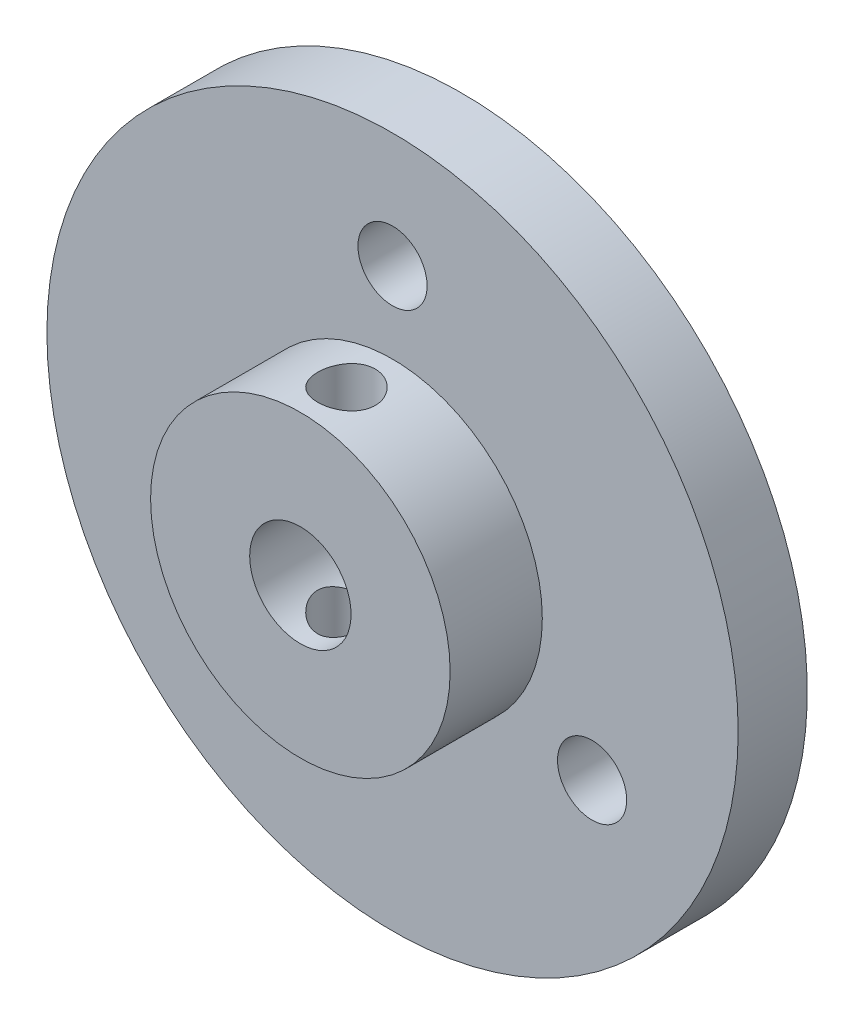
from build123d import *

# Parameters (mm, degrees)
SKETCH1_R               = 15
SKETCH1_R_2             = 2.2
SKETCH1_R_3             = 1.5
BOSS_EXTRUDE1_DEPTH     = 5
SKETCH2_R               = 6.5
SKETCH2_R_2             = 2.2
BOSS_EXTRUDE2_DEPTH     = 4
BOSS_EXTRUDE3_DEPTH     = 4
SKETCH3_W               = 6
SKETCH3_H               = 2.5
CUT_EXTRUDE1_DEPTH      = 24.043437244
SKETCH5_R               = 1.25
CUT_EXTRUDE2_DEPTH      = 7
SKETCH6_W               = 9
SKETCH6_H               = 2.5
BOSS_EXTRUDE4_DEPTH     = 6
CUT_EXTRUDE3_START      = -4
CUT_EXTRUDE3_DEPTH      = 4
CUT_EXTRUDE4_DEPTH      = 2
CUT_EXTRUDE4_DEPTH_BACK = 14
SKETCH8_R               = 1.25
SKETCH9_R               = 15
CUT_EXTRUDE5_DEPTH      = 2


with BuildPart() as part:
    # Sketch1 → Boss-Extrude1 (new body)
    with BuildSketch(Plane.XY):
        Circle(SKETCH1_R)
        Circle(SKETCH1_R_2, mode=Mode.SUBTRACT)
        with Locations((0, 10)):
            Circle(SKETCH1_R_3, mode=Mode.SUBTRACT)
        with Locations((8.660254038, -5)):
            Circle(SKETCH1_R_3, mode=Mode.SUBTRACT)
        with Locations((-8.660254038, -5)):
            Circle(SKETCH1_R_3, mode=Mode.SUBTRACT)
    extrude(amount=BOSS_EXTRUDE1_DEPTH)

    # Sketch2 → Boss-Extrude2 (add)
    with BuildSketch(Plane.XY.offset(5)):
        Circle(SKETCH2_R)
        Circle(SKETCH2_R_2, mode=Mode.SUBTRACT)
    extrude(amount=BOSS_EXTRUDE2_DEPTH)

    # Sketch4 → Boss-Extrude3 (add)
    with BuildSketch(Plane.XY.offset(5)):
        with BuildLine():
            Line((-4.5, 7.69041576), (-4.5, 4.69041576))
            ThreePointArc((-4.5, 4.69041576), (0, 6.5), (4.5, 4.69041576))
            Line((4.5, 4.69041576), (4.5, 7.69041576))
            Line((4.5, 7.69041576), (-4.5, 7.69041576))
        make_face()
    extrude(amount=BOSS_EXTRUDE3_DEPTH)

    # Sketch3 → Cut-Extrude1 (cut, through all)
    with BuildSketch(Plane.XY.offset(9)):
        with Locations((0, 4.35)):
            Rectangle(SKETCH3_W, SKETCH3_H)
    extrude(amount=-CUT_EXTRUDE1_DEPTH, mode=Mode.SUBTRACT)

    # Sketch5 → Cut-Extrude2 (cut)
    with BuildSketch(Plane(origin=(0, 7.69041576, 0), x_dir=(1, 0, 0), z_dir=(0, 1, 0))):
        with Locations(Location((0, -7, 0), (0, 0, 270))):
            Circle(SKETCH5_R)
    extrude(amount=-CUT_EXTRUDE2_DEPTH, mode=Mode.SUBTRACT)

    # Sketch6 → Boss-Extrude4 (add)
    with BuildSketch(Plane(origin=(-3, 0, 0), x_dir=(0, 0, -1), z_dir=(1, 0, 0))):
        with Locations((-4.5, 4.35)):
            Rectangle(SKETCH6_W, SKETCH6_H)
    extrude(amount=BOSS_EXTRUDE4_DEPTH)

    # Sketch7 → Cut-Extrude3 (cut)
    with BuildSketch(Plane.XY.offset(9).offset(CUT_EXTRUDE3_START)):
        with BuildLine():
            ThreePointArc((-4.5, 4.69041576), (0, 6.5), (4.5, 4.69041576))
            Line((4.5, 4.69041576), (4.5, 7.69041576))
            Line((4.5, 7.69041576), (-4.5, 7.69041576))
            Line((-4.5, 7.69041576), (-4.5, 4.69041576))
        make_face()
    extrude(amount=CUT_EXTRUDE3_DEPTH, mode=Mode.SUBTRACT)

    # Sketch8 → Cut-Extrude4 (cut, two sides: drawn at the far end of the back side and taken through both)
    with BuildSketch(Plane(origin=(0, 5.6, 0), x_dir=(1, 0, 0), z_dir=(0, 1, 0)).offset(-CUT_EXTRUDE4_DEPTH_BACK)):
        with Locations(Location((0, -7, 0), (0, 0, 270))):
            Circle(SKETCH8_R)
    extrude(amount=CUT_EXTRUDE4_DEPTH + CUT_EXTRUDE4_DEPTH_BACK, mode=Mode.SUBTRACT)

    # Sketch9 → Cut-Extrude5 (cut)
    with BuildSketch(Plane(origin=(0, 0, 0), x_dir=(-1, 0, 0), z_dir=(0, 0, -1))):
        Circle(SKETCH9_R)
    extrude(amount=-CUT_EXTRUDE5_DEPTH, mode=Mode.SUBTRACT)


solid = part.part
